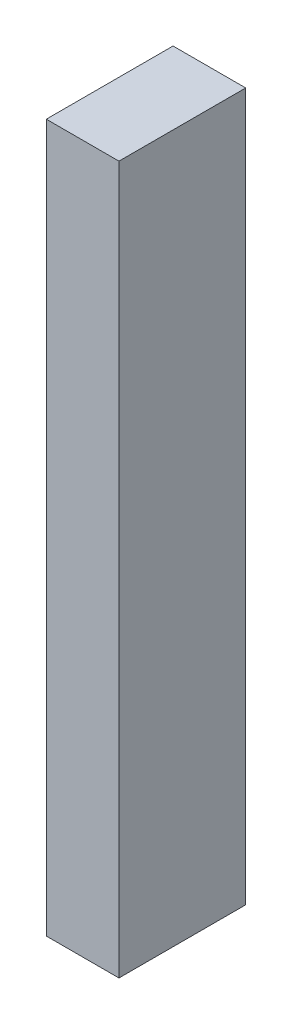
from build123d import *

# Parameters (mm, degrees)
SKICA1_W                = 4.93
SKICA1_H                = 48
P_IDAT_VYSUNUT_M1_DEPTH = 8.6


with BuildPart() as part:
    # Skica1 → Přidat vysunutím1 (new body)
    with BuildSketch(Plane.XY):
        Rectangle(SKICA1_W, SKICA1_H)
    extrude(amount=P_IDAT_VYSUNUT_M1_DEPTH)


solid = part.part
